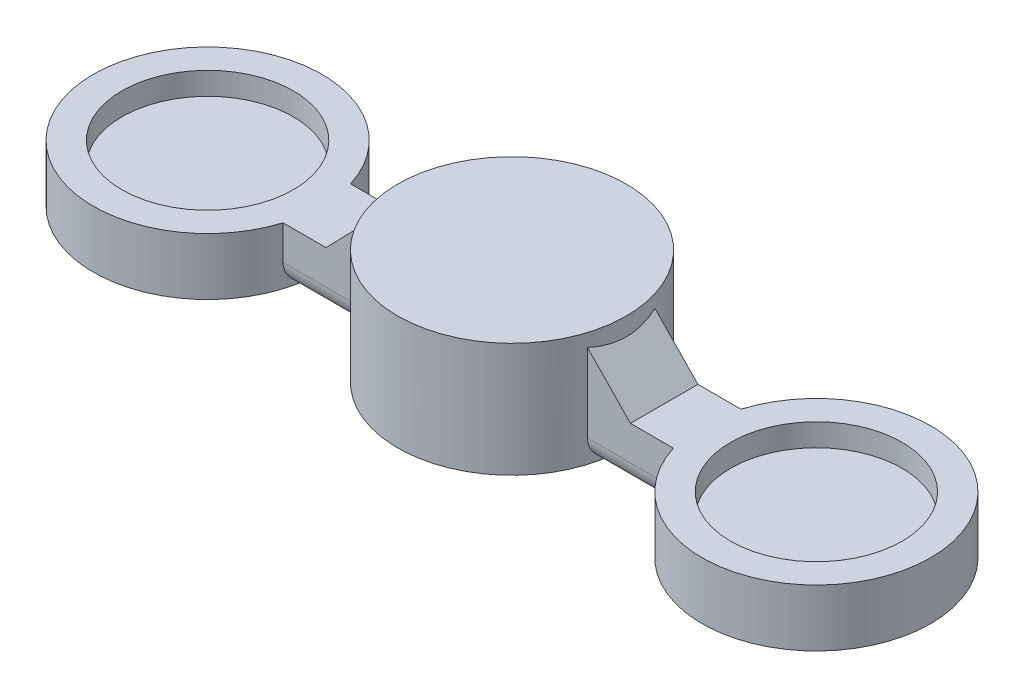
from build123d import *

# Parameters (mm, degrees)
SKETCH1_R           = 12.7
BOSS_EXTRUDE1_DEPTH = 6.35
SKETCH2_W           = 76.2
SKETCH2_H           = 7.5
BOSS_EXTRUDE2_DEPTH = 6.35
SKETCH3_R           = 12.7
BOSS_EXTRUDE3_DEPTH = 6.35
SKETCH4_R           = 9.525
CUT_EXTRUDE1_DEPTH  = 2.5
FILLET1_R           = 2.54
SKETCH5_R           = 12.7
BOSS_EXTRUDE4_DEPTH = 6.35
RIB6_REACH          = 52.95
SKETCH6_WALL_W      = 112.745676574
SKETCH6_WALL_H      = 7.5


with BuildPart() as part:
    # Sketch1 → Boss-Extrude1 (new body)
    with BuildSketch(Plane(origin=(0, 0, 0), x_dir=(1, 0, 0), z_dir=(0, 1, 0))):
        with Locations(Location((0, 0, 0), (0, 0, 270))):
            Circle(SKETCH1_R)
    extrude(amount=BOSS_EXTRUDE1_DEPTH)

    # Sketch2 → Boss-Extrude2 (add)
    with BuildSketch(Plane(origin=(0, 6.35, 0), x_dir=(1, 0, 0), z_dir=(0, 1, 0))):
        Rectangle(SKETCH2_W, SKETCH2_H)
    extrude(amount=-BOSS_EXTRUDE2_DEPTH)

    # Sketch3 → Boss-Extrude3 (add)
    with BuildSketch(Plane(origin=(0, 6.35, 0), x_dir=(1, 0, 0), z_dir=(0, 1, 0))):
        with Locations((-33.819087464, 0)):
            Circle(SKETCH3_R)
    boss_extrude3 = extrude(amount=-BOSS_EXTRUDE3_DEPTH)

    # Sketch4 → Cut-Extrude1 (cut)
    with BuildSketch(Plane(origin=(0, 6.35, 0), x_dir=(1, 0, 0), z_dir=(0, 1, 0))):
        with Locations(Location((-33.819087464, 0, 0), (0, 0, 270))):
            Circle(SKETCH4_R)
    cut_extrude1 = extrude(amount=-CUT_EXTRUDE1_DEPTH, mode=Mode.SUBTRACT)

    # Mirror1: Boss-Extrude3, Cut-Extrude1 across plane
    add(boss_extrude3.mirror(Plane(origin=(0, 0, 0), x_dir=(0, 0, 1), z_dir=(1, 0, 0))))
    add(cut_extrude1.mirror(Plane(origin=(0, 0, 0), x_dir=(0, 0, 1), z_dir=(1, 0, 0))), mode=Mode.SUBTRACT)

    # Fillet1
    fillet1_edges = [part.edges().sort_by_distance(p)[0] for p in [
        (16.909543732, 0, -3.75),
        (-16.909543732, 0, 3.75),
        (-16.909543732, 0, -3.75),
        (16.909543732, 0, 3.75),
    ]]
    fillet(fillet1_edges, radius=FILLET1_R)

    # Sketch5 → Boss-Extrude4 (add)
    with BuildSketch(Plane(origin=(0, 6.35, 0), x_dir=(1, 0, 0), z_dir=(0, 1, 0))):
        with Locations(Location((0, 0, 0), (0, 0, 17.174063718))):
            Circle(SKETCH5_R)
    extrude(amount=BOSS_EXTRUDE4_DEPTH)

    # Sketch6 wall → Rib6 (add, up to next)
    with BuildSketch(Plane(origin=(13.830659707, 9.525, -3.75), x_dir=(-0.696157040024, 0.717889528845, 0), z_dir=(0.717889528845, 0.696157040024, 0)), mode=Mode.PRIVATE) as rib6_sk1:
        with Locations((0, 3.75)):
            Rectangle(SKETCH6_WALL_W, SKETCH6_WALL_H)
    rib6_tool1 = extrude(rib6_sk1.sketch, amount=-RIB6_REACH, mode=Mode.PRIVATE) - part.part
    rib6 = rib6_tool1.solids().sort_by_distance((13.830659707, 9.525, -3.75))[0]
    add(rib6)

    # Mirror2: Rib6 mirrored; each copy of Rib6 runs up to whatever stops it at its own place
    mirror2_before = part.part  # the part as the pattern finds it: every copy runs up to it
    mirror2_rib6_long = extrude(rib6_sk1.sketch, amount=-RIB6_REACH, mode=Mode.PRIVATE)
    mirror2_rib6_tool1 = mirror2_rib6_long.mirror(Plane(origin=(0, 0, 0), x_dir=(0, 0, 1), z_dir=(1, 0, 0))) - mirror2_before
    add(mirror2_rib6_tool1.solids().sort_by_distance((-13.83066, 9.525, -3.75))[0])


solid = part.part
